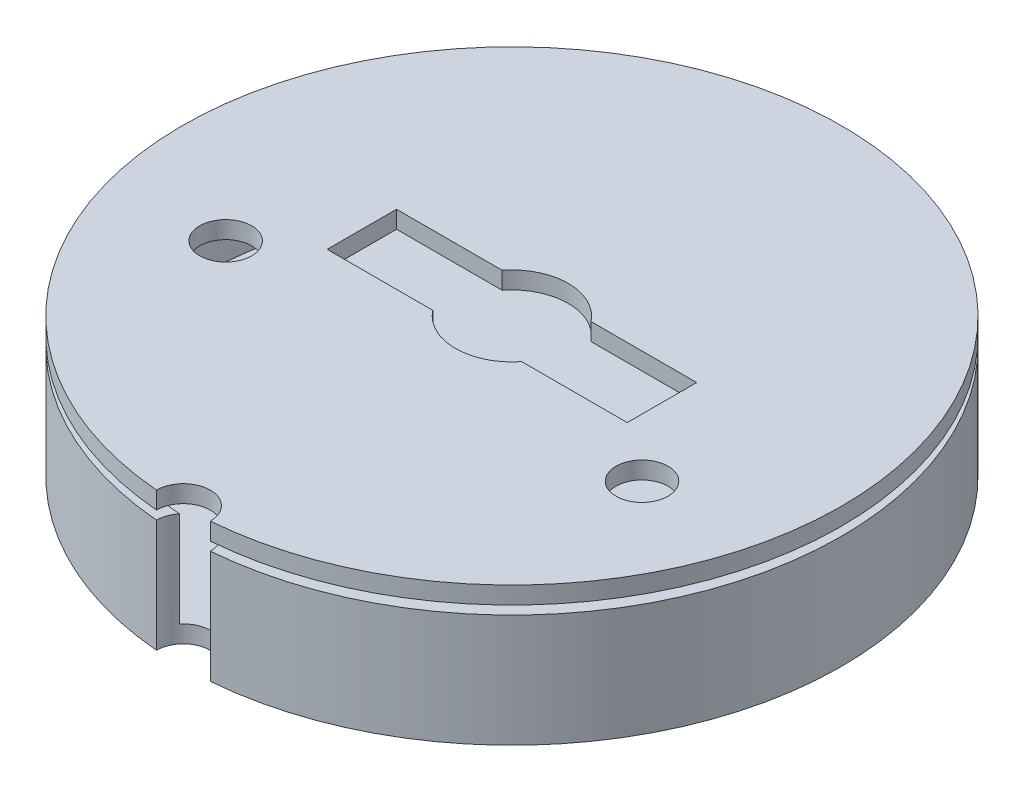
from build123d import *

# Parameters (mm, degrees)
SKETCH1_R               = 5.588
BOSS_EXTRUDE1_DEPTH     = 20.32
CUT_EXTRUDE5_START      = 2.54
SKETCH5_R               = 8.255
CUT_EXTRUDE5_DEPTH      = 47.498
CUT_EXTRUDE7_START      = 17.78
SKETCH6_R               = 45.72
CUT_EXTRUDE7_DEPTH      = 15.24
CUT_EXTRUDE8_START      = 10.16
SKETCH7_W               = 43.942
SKETCH7_H               = 10.16
CUT_EXTRUDE8_DEPTH      = 28.448
CUT_EXTRUDE9_DEPTH      = 72.898
CUT_EXTRUDE9_DEPTH_BACK = 70.612
SKETCH8_W               = 108.573094023
SKETCH8_H               = 1.27
SKETCH9_R               = 3.81
CUT_EXTRUDE10_DEPTH     = 39.37


with BuildPart() as part:
    # Sketch1 → Boss-Extrude1 (new body)
    with BuildSketch(Plane(origin=(0, 0, 0), x_dir=(1, 0, 0), z_dir=(0, 1, 0))):
        with BuildLine():
            ThreePointArc((3.937, -48.099143766), (0, 48.26), (-3.937, -48.099143766))
            ThreePointArc((-3.937, -48.099143766), (0, -44.162143766), (3.937, -48.099143766))
        make_face()
        with Locations(Location((0, 0, 0), (0, 0, 270))):
            Circle(SKETCH1_R, mode=Mode.SUBTRACT)
    extrude(amount=BOSS_EXTRUDE1_DEPTH)

    # Sketch5 → Cut-Extrude5 (cut)
    with BuildSketch(Plane(origin=(0, 0, 0), x_dir=(1, 0, 0), z_dir=(0, 1, 0)).offset(CUT_EXTRUDE5_START)):
        with Locations(Location((0, 0, 0), (0, 0, 90))):
            Circle(SKETCH5_R)
    extrude(amount=CUT_EXTRUDE5_DEPTH, mode=Mode.SUBTRACT)

    # Sketch6 → Cut-Extrude7 (cut)
    with BuildSketch(Plane(origin=(0, 0, 0), x_dir=(1, 0, 0), z_dir=(0, 1, 0)).offset(CUT_EXTRUDE7_START)):
        Circle(SKETCH6_R)
    extrude(amount=-CUT_EXTRUDE7_DEPTH, mode=Mode.SUBTRACT)

    # Sketch7 → Cut-Extrude8 (cut)
    with BuildSketch(Plane(origin=(0, 0, 0), x_dir=(1, 0, 0), z_dir=(0, 1, 0)).offset(CUT_EXTRUDE8_START)):
        Rectangle(SKETCH7_W, SKETCH7_H)
    extrude(amount=CUT_EXTRUDE8_DEPTH, mode=Mode.SUBTRACT)

    # Sketch8 → Cut-Extrude9 (cut, two sides: drawn at the far end of the back side and taken through both)
    with BuildSketch(Plane(origin=(0, 0, 0), x_dir=(0, 0, -1), z_dir=(1, 0, 0)).offset(-CUT_EXTRUDE9_DEPTH_BACK)):
        with Locations((1.451126255, 17.145)):
            Rectangle(SKETCH8_W, SKETCH8_H)
    extrude(amount=CUT_EXTRUDE9_DEPTH + CUT_EXTRUDE9_DEPTH_BACK, mode=Mode.SUBTRACT)


with BuildPart() as cut_extrude9_piece_1:
    # of the separate pieces the step leaves, piece 1, a body of its own (cut_extrude9_pieces)
    add(part.part.solids().sort_by_distance((-3.937, 0, 48.099143766))[0])


with BuildPart() as cut_extrude9_piece_2:
    # of the separate pieces the step leaves, piece 2, a body of its own (cut_extrude9_pieces)
    add(part.part.solids().sort_by_distance((-3.937, 17.78, 48.099143766))[0])


with BuildPart() as cut_extrude10_tool:
    # Sketch9 → Cut-Extrude10 (new body)
    with BuildSketch(Plane(origin=(0, 0, 0), x_dir=(1, 0, 0), z_dir=(0, 1, 0))):
        with Locations(Location((-30.48, -11.43, 0), (0, 0, 270))):
            Circle(SKETCH9_R)
        with Locations(Location((30.48, -11.43, 0), (0, 0, 270))):
            Circle(SKETCH9_R)
    extrude(amount=CUT_EXTRUDE10_DEPTH)


with BuildPart() as cut_extrude9_piece_1_1:
    add(cut_extrude9_piece_1.part)

    # Cut-Extrude10: cut by cut_extrude10_tool
    add(cut_extrude10_tool.part, mode=Mode.SUBTRACT)


with BuildPart() as cut_extrude9_piece_2_1:
    add(cut_extrude9_piece_2.part)

    # Cut-Extrude10: cut by cut_extrude10_tool
    add(cut_extrude10_tool.part, mode=Mode.SUBTRACT)


solid = Compound([cut_extrude9_piece_1_1.part, cut_extrude9_piece_2_1.part])
